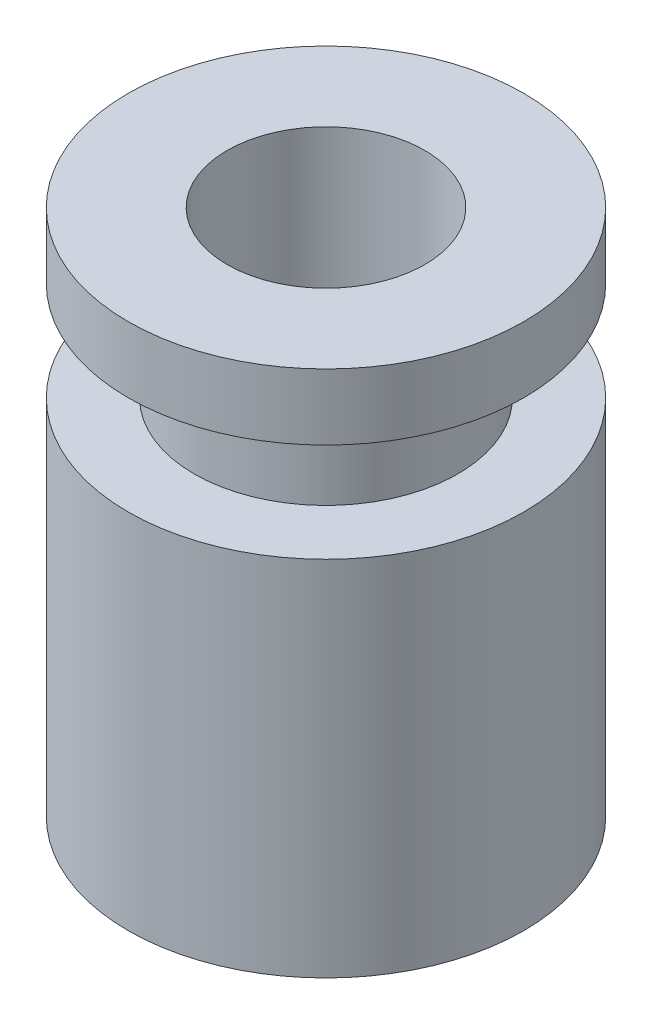
from build123d import *

# Parameters (mm, degrees)
SKETCH_1_R      = 3
SKETCH_1_R_2    = 1.5
EXTRUDE_1_DEPTH = 5.5
SKETCH_2_R      = 2
SKETCH_2_R_2    = 1.5
EXTRUDE_2_DEPTH = 1.5
SKETCH_3_R      = 3
SKETCH_3_R_2    = 1.5
EXTRUDE_4_DEPTH = 1


with BuildPart() as part:
    # 草图1 → 凸台-拉伸1 (new body)
    with BuildSketch(Plane(origin=(0, 0, 0), x_dir=(1, 0, 0), z_dir=(0, 1, 0))):
        with Locations(Location((0, 0, 0), (0, 0, 270))):
            Circle(SKETCH_1_R)
        with Locations(Location((0, 0, 0), (0, 0, 270))):
            Circle(SKETCH_1_R_2, mode=Mode.SUBTRACT)
    extrude(amount=EXTRUDE_1_DEPTH)

    # 草图2 → 凸台-拉伸2 (add)
    with BuildSketch(Plane(origin=(0, 5.5, 0), x_dir=(1, 0, 0), z_dir=(0, 1, 0))):
        with Locations(Location((0, 0, 0), (0, 0, 270))):
            Circle(SKETCH_2_R)
        with Locations(Location((0, 0, 0), (0, 0, 270))):
            Circle(SKETCH_2_R_2, mode=Mode.SUBTRACT)
    extrude(amount=EXTRUDE_2_DEPTH)

    # 草图3 → 凸台-拉伸4 (add)
    with BuildSketch(Plane(origin=(0, 7, 0), x_dir=(1, 0, 0), z_dir=(0, 1, 0))):
        with Locations(Location((0, 0, 0), (0, 0, 270))):
            Circle(SKETCH_3_R)
        with Locations(Location((0, 0, 0), (0, 0, 270))):
            Circle(SKETCH_3_R_2, mode=Mode.SUBTRACT)
    extrude(amount=EXTRUDE_4_DEPTH)


solid = part.part
